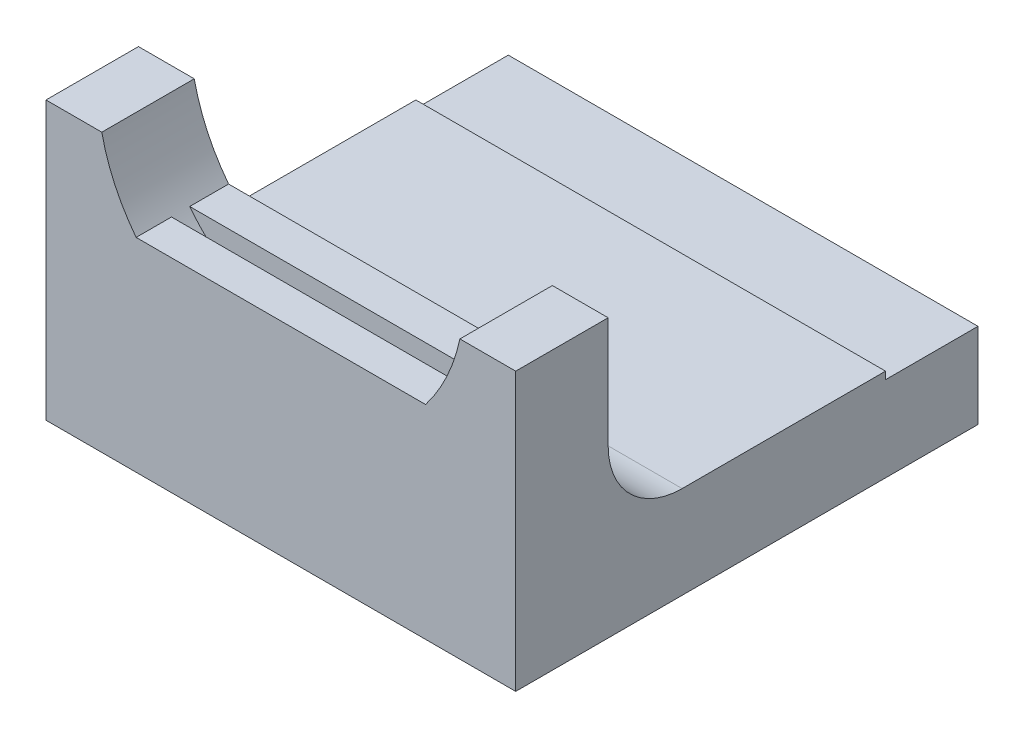
from build123d import *

# Parameters (mm, degrees)
SKETCH1_W           = 53.34
SKETCH1_H           = 152.4
SKETCH1_R           = 1
BOSS_EXTRUDE1_DEPTH = 6.35
SKETCH2_W           = 32.258
SKETCH2_H           = 6.35
BOSS_EXTRUDE2_DEPTH = 31.75
SKETCH3_W           = 32.258
SKETCH3_H           = 6.35
BOSS_EXTRUDE3_DEPTH = 12.7
CUT_EXTRUDE1_REACH  = 136.322
SKETCH4_R           = 12.573
SKETCH5_W           = 32.258
SKETCH5_H           = 2.671239047
SKETCH5_H_2         = 2.428760953
BOSS_EXTRUDE4_DEPTH = 7.62
FILLET1_R           = 5.08
SKETCH8_W           = 53.34
SKETCH8_H           = 152.4
CUT_EXTRUDE4_DEPTH  = 133.964296911
SKETCH9_W           = 32.258
SKETCH9_H           = 5.842
BOSS_EXTRUDE6_DEPTH = 6.35


with BuildPart() as part:
    # Sketch1 → Boss-Extrude1 (new body)
    with BuildSketch(Plane.XY):
        with Locations((-17.091445783, 46.760481928)):
            Rectangle(SKETCH1_W, SKETCH1_H)
        with Locations((-36.141445783, 69.620481928)):
            Circle(SKETCH1_R, mode=Mode.SUBTRACT)
        with Locations((-8.201445783, 69.620481928)):
            Circle(SKETCH1_R, mode=Mode.SUBTRACT)
        with Locations((-41.221445783, 121.690481928)):
            Circle(SKETCH1_R, mode=Mode.SUBTRACT)
        with Locations((7.038554217, 120.420481928)):
            Circle(SKETCH1_R, mode=Mode.SUBTRACT)
    extrude(amount=BOSS_EXTRUDE1_DEPTH)

    # Sketch2 → Boss-Extrude2 (add)
    with BuildSketch(Plane.XY):
        with Locations((-17.091445783, 60.014063864)):
            Rectangle(SKETCH2_W, SKETCH2_H)
    extrude(amount=BOSS_EXTRUDE2_DEPTH)

    # Sketch3 → Boss-Extrude3 (add)
    with BuildSketch(Plane(origin=(0, 63.189063864, 0), x_dir=(1, 0, 0), z_dir=(0, 1, 0))):
        with Locations((-17.091445783, -28.575)):
            Rectangle(SKETCH3_W, SKETCH3_H)
    extrude(amount=BOSS_EXTRUDE3_DEPTH)

    # Sketch4 → Cut-Extrude1 (cut, up to next)
    with BuildSketch(Plane.XY.offset(31.75), mode=Mode.PRIVATE) as cut_extrude1_sk1:
        with Locations((-17.091445783, 78.510481928)):
            Circle(SKETCH4_R)
    cut_extrude1_tool1 = extrude(cut_extrude1_sk1.sketch, amount=-CUT_EXTRUDE1_REACH, mode=Mode.PRIVATE) & part.part
    add(cut_extrude1_tool1.solids().sort_by_distance((-17.091446, 78.510482, 31.75))[0], mode=Mode.SUBTRACT)

    # Sketch5 → Boss-Extrude4 (add)
    with BuildSketch(Plane(origin=(0, 63.189063864, 0), x_dir=(1, 0, 0), z_dir=(0, 1, 0))):
        with Locations((-17.091445783, -26.735619524)):
            Rectangle(SKETCH5_W, SKETCH5_H)
        with Locations((-17.091445783, -30.535619524)):
            Rectangle(SKETCH5_W, SKETCH5_H_2)
    extrude(amount=BOSS_EXTRUDE4_DEPTH)

    # Fillet1
    fillet1_edges = [part.edges().sort_by_distance(p)[0] for p in [
        (-17.091445783, 63.189063864, 25.4),
    ]]
    fillet(fillet1_edges, radius=FILLET1_R)

    # Sketch8 → Cut-Extrude4 (cut, through all)
    with BuildSketch(Plane.XY.offset(6.35)):
        with Locations((-17.091445783, 46.760481928)):
            Rectangle(SKETCH8_W, SKETCH8_H)
    extrude(amount=-CUT_EXTRUDE4_DEPTH, mode=Mode.SUBTRACT)

    # Sketch9 → Boss-Extrude6 (add)
    with BuildSketch(Plane(origin=(0, 0, 6.35), x_dir=(-1, 0, 0), z_dir=(0, 0, -1))):
        with Locations((17.091445783, 59.760063864)):
            Rectangle(SKETCH9_W, SKETCH9_H)
    extrude(amount=BOSS_EXTRUDE6_DEPTH)


solid = part.part
